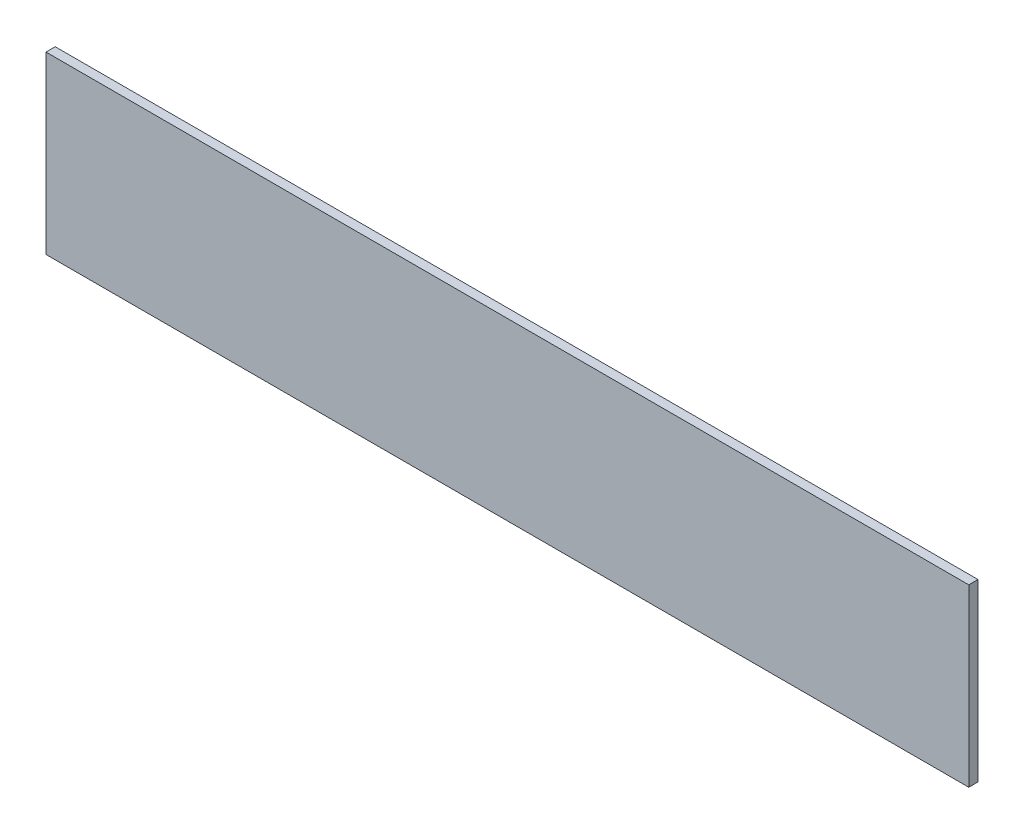
from build123d import *

# Parameters (mm, degrees)
SKETCH_1_W      = 500
SKETCH_1_H      = 95
EXTRUDE_1_DEPTH = 5


with BuildPart() as part:
    # 草图1 → 凸台-拉伸1 (new body)
    with BuildSketch(Plane.XY):
        with Locations((9.398496241, 119.913383731)):
            Rectangle(SKETCH_1_W, SKETCH_1_H)
    extrude(amount=EXTRUDE_1_DEPTH)


solid = part.part
